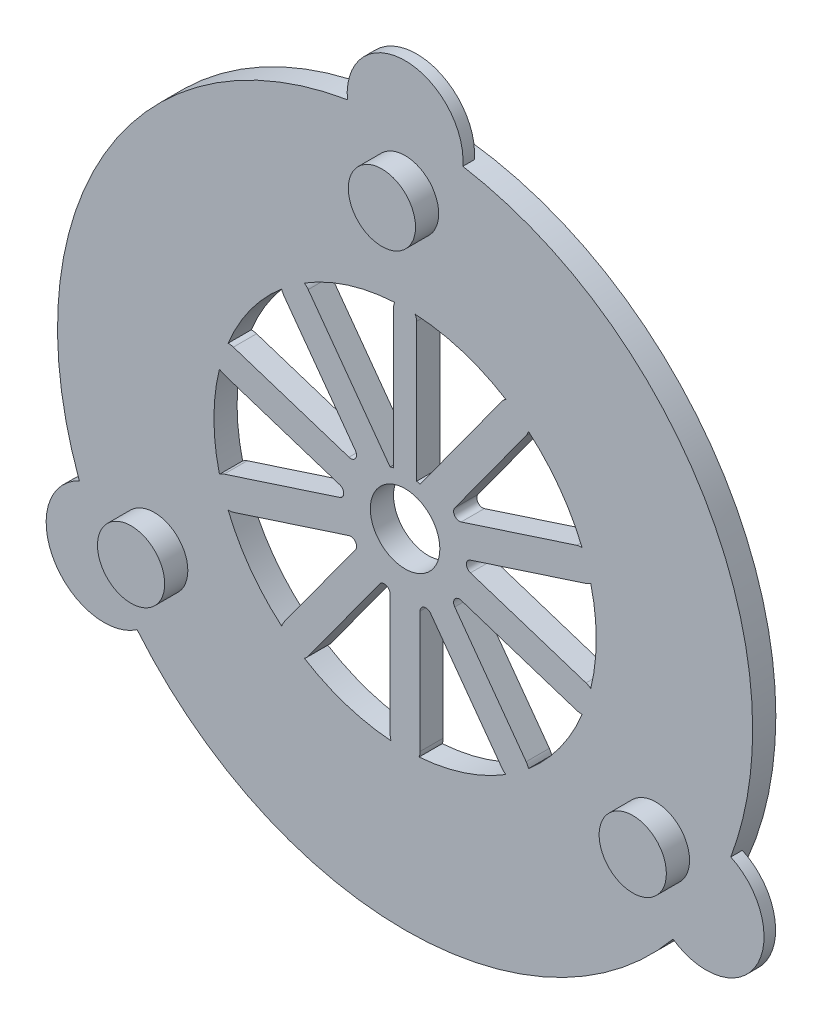
from build123d import *

# Parameters (mm, degrees)
BOSS_EXTRUDE1_DEPTH    = 2
BOSS_EXTRUDE1_2_DEPTH  = 2
BOSS_EXTRUDE1_3_DEPTH  = 2
BOSS_EXTRUDE1_4_DEPTH  = 2
BOSS_EXTRUDE1_5_DEPTH  = 2
BOSS_EXTRUDE1_6_DEPTH  = 2
BOSS_EXTRUDE1_7_DEPTH  = 2
BOSS_EXTRUDE1_8_DEPTH  = 2
BOSS_EXTRUDE1_9_DEPTH  = 2
BOSS_EXTRUDE1_10_DEPTH = 2
SKETCH3_R              = 30
SKETCH3_R_2            = 16.5
BOSS_EXTRUDE2_DEPTH    = 2
SKETCH4_R              = 2.9
BOSS_EXTRUDE3_DEPTH    = 2
SKETCH6_R              = 5
BOSS_EXTRUDE4_DEPTH    = 1
SKETCH13_R             = 4.177329345
BOSS_EXTRUDE6_DEPTH    = 2
FILLET2_R              = 0.5
SKETCH14_R             = 3
CUT_EXTRUDE1_DEPTH     = 20


with BuildPart() as part:
    # Sketch2 → Boss-Extrude1 (new body)
    with BuildSketch(Plane.XY.offset(10)):
        with BuildLine():
            Line((8.357492916, 13.704694326), (0.999285991, 3.572733706))
            Line((0.999285991, 3.572733706), (0.999663781, 1.6824161))
            Line((0.999663781, 1.6824161), (3.379039645, 2.45604795))
            Line((3.379039645, 2.45604795), (10.446460828, 12.187608075))
            ThreePointArc((10.446460828, 12.187608075), (10.160519997, 13.990635156), (8.357492916, 13.704694326))
        make_face()
    extrude(amount=BOSS_EXTRUDE1_DEPTH)


with BuildPart() as body_2:
    # Sketch2 → Boss-Extrude1 2 (new body)
    with BuildSketch(Plane.XY.offset(10)):
        with BuildLine():
            Line((0.999285991, 3.572733706), (0.996802301, 16.000199535))
            ThreePointArc((0.996802301, 16.000199535), (-0.003397534, 16.99999966), (-1.003197659, 15.999799826))
            Line((-1.003197659, 15.999799826), (-1.000713969, 3.572333996))
            Line((-1.000713969, 3.572333996), (-0.000438912, 2.196151958))
            Line((-0.000438912, 2.196151958), (0.999285991, 3.572733706))
        make_face()
    extrude(amount=BOSS_EXTRUDE1_2_DEPTH)


with BuildPart() as body_3:
    # Sketch2 → Boss-Extrude1 3 (new body)
    with BuildSketch(Plane.XY.offset(10)):
        with BuildLine():
            Line((-1.000336179, 1.68201639), (-1.000713969, 3.572333996))
            Line((-1.000713969, 3.572333996), (-8.362970151, 13.701352658))
            ThreePointArc((-8.362970151, 13.701352658), (-10.166111381, 13.986572778), (-10.451331501, 12.183431547))
            Line((-10.451331501, 12.183431547), (-3.380021082, 2.454697118))
            Line((-3.380021082, 2.454697118), (-1.000336179, 1.68201639))
        make_face()
    extrude(amount=BOSS_EXTRUDE1_3_DEPTH)


with BuildPart() as body_4:
    # Sketch2 → Boss-Extrude1 4 (new body)
    with BuildSketch(Plane.XY.offset(10)):
        with BuildLine():
            Line((-2.088800262, 0.678230847), (-3.380021082, 2.454697118))
            Line((-3.380021082, 2.454697118), (-14.819238004, 6.168996626))
            ThreePointArc((-14.819238004, 6.168996626), (-16.445658083, 5.339884727), (-15.616546184, 3.713464648))
            Line((-15.616546184, 3.713464648), (-4.177329262, -0.00083486))
            Line((-4.177329262, -0.00083486), (-2.088800262, 0.678230847))
        make_face()
    extrude(amount=BOSS_EXTRUDE1_4_DEPTH)


with BuildPart() as body_5:
    # Sketch2 → Boss-Extrude1 5 (new body)
    with BuildSketch(Plane.XY.offset(10)):
        with BuildLine():
            Line((-2.088529, -0.679065707), (-4.177329262, -0.00083486))
            Line((-4.177329262, -0.00083486), (-15.615060628, -3.71970644))
            ThreePointArc((-15.615060628, -3.71970644), (-16.443522365, -5.346457793), (-14.816771011, -6.17491953))
            Line((-14.816771011, -6.17491953), (-3.379039645, -2.45604795))
            Line((-3.379039645, -2.45604795), (-2.088529, -0.679065707))
        make_face()
    extrude(amount=BOSS_EXTRUDE1_5_DEPTH)


with BuildPart() as body_6:
    # Sketch2 → Boss-Extrude1 6 (new body)
    with BuildSketch(Plane.XY.offset(10)):
        with BuildLine():
            Line((-1.290510646, -1.776982243), (-3.379039645, -2.45604795))
            Line((-3.379039645, -2.45604795), (-10.446460828, -12.187608075))
            ThreePointArc((-10.446460828, -12.187608075), (-10.160519997, -13.990635156), (-8.357492916, -13.704694326))
            Line((-8.357492916, -13.704694326), (-1.290071734, -3.973134201))
            Line((-1.290071734, -3.973134201), (-1.290510646, -1.776982243))
        make_face()
    extrude(amount=BOSS_EXTRUDE1_6_DEPTH)


with BuildPart() as body_7:
    # Sketch2 → Boss-Extrude1 7 (new body)
    with BuildSketch(Plane.XY.offset(10)):
        with BuildLine():
            Line((1.294063412, -15.999741695), (1.291659732, -3.972618229))
            Line((1.291659732, -3.972618229), (0.000438912, -2.196151958))
            Line((0.000438912, -2.196151958), (-1.290071734, -3.973134201))
            Line((-1.290071734, -3.973134201), (-1.287668054, -16.000257666))
            ThreePointArc((-1.287668054, -16.000257666), (0.003455665, -17.290865413), (1.294063412, -15.999741695))
        make_face()
    extrude(amount=BOSS_EXTRUDE1_7_DEPTH)


with BuildPart() as body_8:
    # Sketch2 → Boss-Extrude1 8 (new body)
    with BuildSketch(Plane.XY.offset(10)):
        with BuildLine():
            Line((10.451331501, -12.183431547), (3.380021082, -2.454697118))
            Line((3.380021082, -2.454697118), (1.29122082, -1.776466271))
            Line((1.29122082, -1.776466271), (1.291659732, -3.972618229))
            Line((1.291659732, -3.972618229), (8.362970151, -13.701352658))
            ThreePointArc((8.362970151, -13.701352658), (10.166111381, -13.986572778), (10.451331501, -12.183431547))
        make_face()
    extrude(amount=BOSS_EXTRUDE1_8_DEPTH)


with BuildPart() as body_9:
    # Sketch2 → Boss-Extrude1 9 (new body)
    with BuildSketch(Plane.XY.offset(10)):
        with BuildLine():
            Line((15.616546184, -3.713464648), (4.177329262, 0.00083486))
            Line((4.177329262, 0.00083486), (2.088800262, -0.678230847))
            Line((2.088800262, -0.678230847), (3.380021082, -2.454697118))
            Line((3.380021082, -2.454697118), (14.819238004, -6.168996626))
            ThreePointArc((14.819238004, -6.168996626), (16.445658083, -5.339884727), (15.616546184, -3.713464648))
        make_face()
    extrude(amount=BOSS_EXTRUDE1_9_DEPTH)


with BuildPart() as body_10:
    # Sketch2 → Boss-Extrude1 10 (new body)
    with BuildSketch(Plane.XY.offset(10)):
        with BuildLine():
            Line((14.816771011, 6.17491953), (3.379039645, 2.45604795))
            Line((3.379039645, 2.45604795), (2.088529, 0.679065707))
            Line((2.088529, 0.679065707), (4.177329262, 0.00083486))
            Line((4.177329262, 0.00083486), (15.615060628, 3.71970644))
            ThreePointArc((15.615060628, 3.71970644), (16.443522365, 5.346457793), (14.816771011, 6.17491953))
        make_face()
    extrude(amount=BOSS_EXTRUDE1_10_DEPTH)


with BuildPart() as body_11:
    # Sketch3 → Boss-Extrude2 (new body)
    with BuildSketch(Plane.XY.offset(12)):
        Circle(SKETCH3_R)
        Circle(SKETCH3_R_2, mode=Mode.SUBTRACT)
    extrude(amount=-BOSS_EXTRUDE2_DEPTH)

    # Sketch4 → Boss-Extrude3 (add)
    with BuildSketch(Plane.XY.offset(12)):
        with Locations((0, 25)):
            Circle(SKETCH4_R)
        with Locations((21.650635095, -12.5)):
            Circle(SKETCH4_R)
        with Locations((-21.650635095, -12.5)):
            Circle(SKETCH4_R)
    extrude(amount=BOSS_EXTRUDE3_DEPTH)

    # Sketch6 → Boss-Extrude4 (add)
    with BuildSketch(Plane(origin=(0, 0, 11), x_dir=(-1, 0, 0), z_dir=(0, 0, -1))):
        with Locations((0, 30)):
            Circle(SKETCH6_R)
        with Locations((25.980762114, -15)):
            Circle(SKETCH6_R)
        with Locations((-25.980762114, -15)):
            Circle(SKETCH6_R)
    extrude(amount=-BOSS_EXTRUDE4_DEPTH)


    add(part.part)  # Boss-Extrude6 merges part

    add(body_3.part)  # Boss-Extrude6 merges body 3

    add(body_5.part)  # Boss-Extrude6 merges body 5

    add(body_7.part)  # Boss-Extrude6 merges body 7

    add(body_9.part)  # Boss-Extrude6 merges body 9

    add(body_2.part)  # Boss-Extrude6 merges body 2

    add(body_4.part)  # Boss-Extrude6 merges body 4

    add(body_6.part)  # Boss-Extrude6 merges body 6

    add(body_8.part)  # Boss-Extrude6 merges body 8

    add(body_10.part)  # Boss-Extrude6 merges body 10
    # Sketch13 → Boss-Extrude6 (add)
    with BuildSketch(Plane(origin=(0, 0, 10), x_dir=(-1, 0, 0), z_dir=(0, 0, -1))):
        Circle(SKETCH13_R)
    extrude(amount=-BOSS_EXTRUDE6_DEPTH)

    # Fillet2
    fillet2_edges = [body_11.edges().sort_by_distance(p)[0] for p in [
        (-1.290071734, -3.973134201, 11),
        (1.291659732, -3.972618229, 11),
        (3.380021082, -2.454697118, 11),
        (4.177329262, 0.00083486, 11),
        (3.379039645, 2.45604795, 11),
        (-3.380021082, 2.454697118, 11),
        (-4.177329262, -0.00083486, 11),
        (-3.379039645, -2.45604795, 11),
    ]]
    fillet(fillet2_edges, radius=FILLET2_R)

    # Sketch14 → Cut-Extrude1 (cut)
    with BuildSketch(Plane(origin=(0, 0, 10), x_dir=(-1, 0, 0), z_dir=(0, 0, -1))):
        Circle(SKETCH14_R)
    extrude(amount=-CUT_EXTRUDE1_DEPTH, mode=Mode.SUBTRACT)


solid = body_11.part
